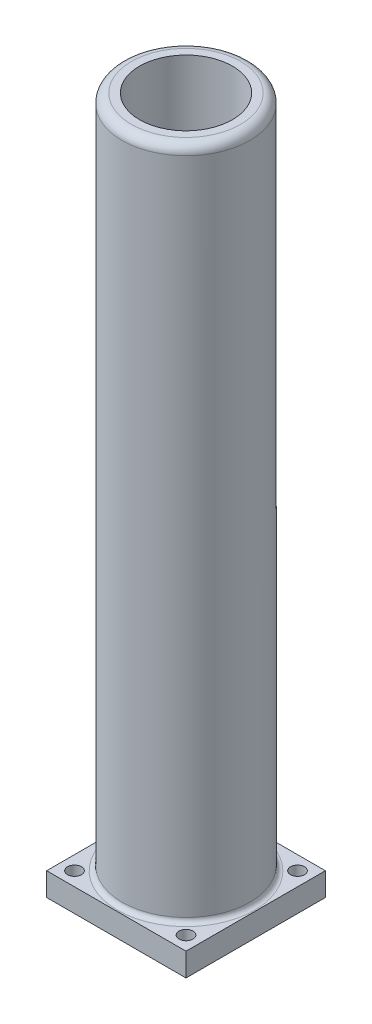
from build123d import *

# Parameters (mm, degrees)
SZKIC1_W                    = 60
SZKIC1_H                    = 60
DODANIE_WYCI_GNI_CIE1_DEPTH = 300
SZKIC2_OUTSIDE_W            = 124.354
SZKIC2_OUTSIDE_H            = 124.354
SZKIC2_OUTSIDE_R            = 27.5
WYTNIJ_WYCI_GNI_CIE1_DEPTH  = 290
SZKIC5_R                    = 20
WYTNIJ_WYCI_GNI_CIE3_DEPTH  = 303.985148151
ZAOKR_GLENIE2_R             = 2
ZAOKR_GLENIE3_R             = 4
OTWORY_USTALAJ_CE_6_0MM1_D  = 6


with BuildPart() as part:
    # Szkic1 → Dodanie-wyciągnięcie1 (new body)
    with BuildSketch(Plane(origin=(0, 0, 0), x_dir=(1, 0, 0), z_dir=(0, 1, 0))):
        Rectangle(SZKIC1_W, SZKIC1_H)
    extrude(amount=DODANIE_WYCI_GNI_CIE1_DEPTH)

    # Szkic2 outside → Wytnij-wyciągnięcie1 (cut)
    with BuildSketch(Plane(origin=(0, 300, 0), x_dir=(1, 0, 0), z_dir=(0, 1, 0))):
        Rectangle(SZKIC2_OUTSIDE_W, SZKIC2_OUTSIDE_H)
        with Locations(Location((0, 0, 0), (0, 0, 270))):
            Circle(SZKIC2_OUTSIDE_R, mode=Mode.SUBTRACT)
    extrude(amount=-WYTNIJ_WYCI_GNI_CIE1_DEPTH, mode=Mode.SUBTRACT)

    # Szkic5 → Wytnij-wyciągnięcie3 (cut, through all)
    with BuildSketch(Plane(origin=(0, 300, 0), x_dir=(1, 0, 0), z_dir=(0, 1, 0))):
        with Locations(Location((0, 0, 0), (0, 0, 270))):
            Circle(SZKIC5_R)
    extrude(amount=-WYTNIJ_WYCI_GNI_CIE3_DEPTH, mode=Mode.SUBTRACT)

    # Zaokrąglenie2
    zaokr_glenie2_edges = [part.edges().sort_by_distance(p)[0] for p in [
        (0, 10, -27.5),
    ]]
    fillet(zaokr_glenie2_edges, radius=ZAOKR_GLENIE2_R)

    # Zaokrąglenie3
    zaokr_glenie3_edges = [part.edges().sort_by_distance(p)[0] for p in [
        (0, 300, -27.5),
    ]]
    fillet(zaokr_glenie3_edges, radius=ZAOKR_GLENIE3_R)

    # Otwory ustalające Ø6.0mm1 (through all)
    with Locations(Plane(origin=(0, 10, 0), x_dir=(1, 0, 0), z_dir=(0, 1, 0))):
        with Locations((-24, -24), (-24, 24), (24, 24), (24, -24)):
            Hole(OTWORY_USTALAJ_CE_6_0MM1_D / 2)


solid = part.part
